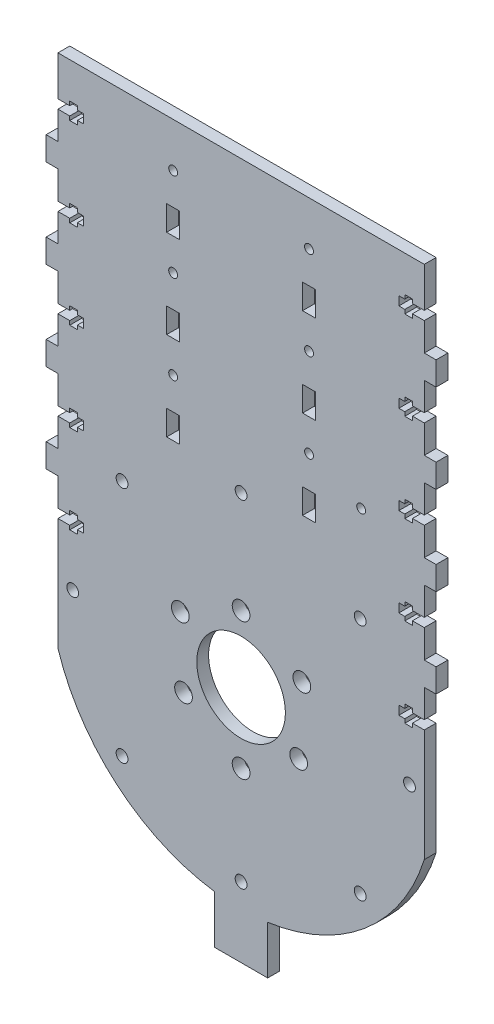
from build123d import *

# Parameters (mm, degrees)
SKETCH_1_R          = 2.28339151
EXTRUDE_1_DEPTH     = 4
SKETCH_3_R          = 3
SKETCH_3_R_2        = 15
SKETCH_3_R_3        = 2
CUT_EXTRUDE_1_DEPTH = 4
SKETCH_6_R          = 1.5
SKETCH_6_W          = 4.4
SKETCH_6_H          = 8.4
CUT_EXTRUDE_3_DEPTH = 4
SKETCH_7_R          = 1.5
CUT_EXTRUDE_5_DEPTH = 10
EXTRUDE_2_DEPTH     = 4


with BuildPart() as part:
    # 草图1 → 凸台-拉伸1 (new body)
    with BuildSketch(Plane.XY):
        Polygon((145, 46.5), (149, 46.5), (149, 45.15), (151.6, 45.15), (151.6, 46.5), (153.6, 46.5), (153.6, 49.5), (151.6, 49.5), (151.6, 50.85), (149, 50.85), (149, 49.5), (145, 49.5), (145, 59), (141, 59), (141, 67), (145, 67), (145, 76.5), (149, 76.5), (149, 75.15), (151.6, 75.15), (151.6, 76.5), (153.6, 76.5), (153.6, 79.5), (151.6, 79.5), (151.6, 80.85), (149, 80.85), (149, 79.5), (145, 79.5), (145, 89), (141, 89), (141, 97), (145, 97), (145, 106.5), (149, 106.5), (149, 105.15), (151.6, 105.15), (151.6, 106.5), (153.6, 106.5), (153.6, 109.5), (151.6, 109.5), (151.6, 110.85), (149, 110.85), (149, 109.5), (145, 109.5), (145, 123), (269, 123), (269, 109.5), (265, 109.5), (265, 110.85), (262.4, 110.85), (262.4, 109.5), (260.4, 109.5), (260.4, 106.5), (262.4, 106.5), (262.4, 105.15), (265, 105.15), (265, 106.5), (269, 106.5), (269, 97), (273, 97), (273, 89), (269, 89), (269, 79.5), (265, 79.5), (265, 80.85), (262.4, 80.85), (262.4, 79.5), (260.4, 79.5), (260.4, 76.5), (262.4, 76.5), (262.4, 75.15), (265, 75.15), (265, 76.5), (269, 76.5), (269, 67), (273, 67), (273, 59), (269, 59), (269, 49.5), (265, 49.5), (265, 50.85), (262.4, 50.85), (262.4, 49.5), (260.4, 49.5), (260.4, 46.5), (262.4, 46.5), (262.4, 45.15), (265, 45.15), (265, 46.5), (269, 46.5), (269, 37), (273, 37), (273, 29), (269, 29), (269, 19.5), (265, 19.5), (265, 20.85), (262.4, 20.85), (262.4, 19.5), (260.4, 19.5), (260.4, 16.5), (262.4, 16.5), (262.4, 15.15), (265, 15.15), (265, 16.5), (269, 16.5), (269, 7), (273, 7), (273, -1), (269, -1), (269, -10.5), (265, -10.5), (265, -9.15), (262.4, -9.15), (262.4, -10.5), (260.4, -10.5), (260.4, -13.5), (262.4, -13.5), (262.4, -14.85), (265, -14.85), (265, -13.5), (269, -13.5), (269, -27), (269, -97), (145, -97), (145, -27), (145, -13.5), (149, -13.5), (149, -14.85), (151.6, -14.85), (151.6, -13.5), (153.6, -13.5), (153.6, -10.5), (151.6, -10.5), (151.6, -9.15), (149, -9.15), (149, -10.5), (145, -10.5), (145, -1), (141, -1), (141, 7), (145, 7), (145, 16.5), (149, 16.5), (149, 15.15), (151.6, 15.15), (151.6, 16.5), (153.6, 16.5), (153.6, 19.5), (151.6, 19.5), (151.6, 20.85), (149, 20.85), (149, 19.5), (145, 19.5), (145, 29), (141, 29), (141, 37), (145, 37), align=None)
        with Locations((262.4, -88.911124512)):
            Circle(SKETCH_1_R, mode=Mode.SUBTRACT)
    extrude(amount=EXTRUDE_1_DEPTH)

    # 草图3 → 切除-拉伸1 (cut)
    with BuildSketch(Plane.XY.offset(4)):
        with Locations((207, -55.75)):
            Circle(SKETCH_3_R)
        with Locations((226.485571585, -43.25)):
            Circle(SKETCH_3_R)
        with Locations((207, -32)):
            Circle(SKETCH_3_R_2)
        with Locations((264, -32)):
            Circle(SKETCH_3_R_3)
        with Locations((186.43189666, -20.125)):
            Circle(SKETCH_3_R)
        with Locations((227.56810334, -20.125)):
            Circle(SKETCH_3_R)
        with Locations((187.514428415, -43.25)):
            Circle(SKETCH_3_R)
        with Locations((207, -9.5)):
            Circle(SKETCH_3_R)
        with Locations((247.305086528, -72.305086528)):
            Circle(SKETCH_3_R_3)
        with Locations((207, -89)):
            Circle(SKETCH_3_R_3)
        with Locations((166.694913472, -72.305086528)):
            Circle(SKETCH_3_R_3)
        with Locations((150, -32)):
            Circle(SKETCH_3_R_3)
        with Locations((166.694913472, 8.305086528)):
            Circle(SKETCH_3_R_3)
        with Locations((207, 25)):
            Circle(SKETCH_3_R_3)
        with Locations((247.305086528, 8.305086528)):
            Circle(SKETCH_3_R_3)
    extrude(amount=-CUT_EXTRUDE_1_DEPTH, mode=Mode.SUBTRACT)

    # 草图6 → 切除-拉伸3 (cut)
    with BuildSketch(Plane.XY.offset(4)):
        with Locations((184, 108)):
            Circle(SKETCH_6_R)
        with Locations((184, 78)):
            Circle(SKETCH_6_R)
        with Locations((184, 48)):
            Circle(SKETCH_6_R)
        with Locations(Location((230, 48, 0), (0, 0, 180))):
            Circle(SKETCH_6_R)
        with Locations(Location((230, 78, 0), (0, 0, 180))):
            Circle(SKETCH_6_R)
        with Locations(Location((230, 108, 0), (0, 0, 180))):
            Circle(SKETCH_6_R)
        with Locations((184, 93)):
            Rectangle(SKETCH_6_W, SKETCH_6_H)
        with Locations((184, 63)):
            Rectangle(SKETCH_6_W, SKETCH_6_H)
        with Locations((184, 33)):
            Rectangle(SKETCH_6_W, SKETCH_6_H)
        with Locations((230, 33)):
            Rectangle(SKETCH_6_W, SKETCH_6_H)
        with Locations((230, 63)):
            Rectangle(SKETCH_6_W, SKETCH_6_H)
        with Locations((230, 93)):
            Rectangle(SKETCH_6_W, SKETCH_6_H)
    extrude(amount=-CUT_EXTRUDE_3_DEPTH, mode=Mode.SUBTRACT)

    # 草图7 → 切除-拉伸5 (cut)
    with BuildSketch(Plane.XY.offset(4)):
        with Locations((247.644363383, 40.735296654)):
            Circle(SKETCH_7_R)
        with BuildLine():
            Line((142, -32), (85.31125556, -32))
            ThreePointArc((85.31125556, -32), (207, -153.68874444), (328.68874444, -32))
            Line((328.68874444, -32), (272, -32))
            ThreePointArc((272, -32), (207, -97), (142, -32))
        make_face()
    extrude(amount=-CUT_EXTRUDE_5_DEPTH, mode=Mode.SUBTRACT)

    # 草图8 → 凸台-拉伸2 (add)
    with BuildSketch(Plane.XY.offset(4)):
        Polygon((198, -112.71554622), (207, -112.71554622), (216, -112.71554622), (216, -91), (198, -91), align=None)
    extrude(amount=-EXTRUDE_2_DEPTH)


solid = part.part
